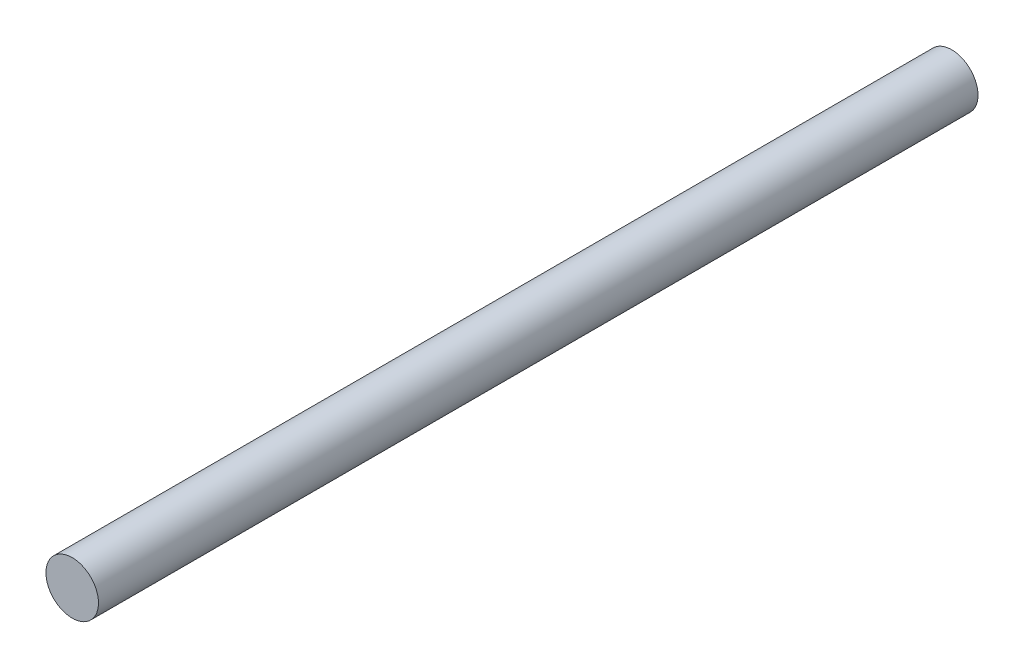
from build123d import *

# Parameters (mm, degrees)
SKETCH1_R           = 20
BOSS_EXTRUDE1_DEPTH = 335


with BuildPart() as part:
    # Sketch1 → Boss-Extrude1 (new, symmetric)
    with BuildSketch(Plane.XY):
        Circle(SKETCH1_R)
    extrude(amount=BOSS_EXTRUDE1_DEPTH, both=True)


solid = part.part
